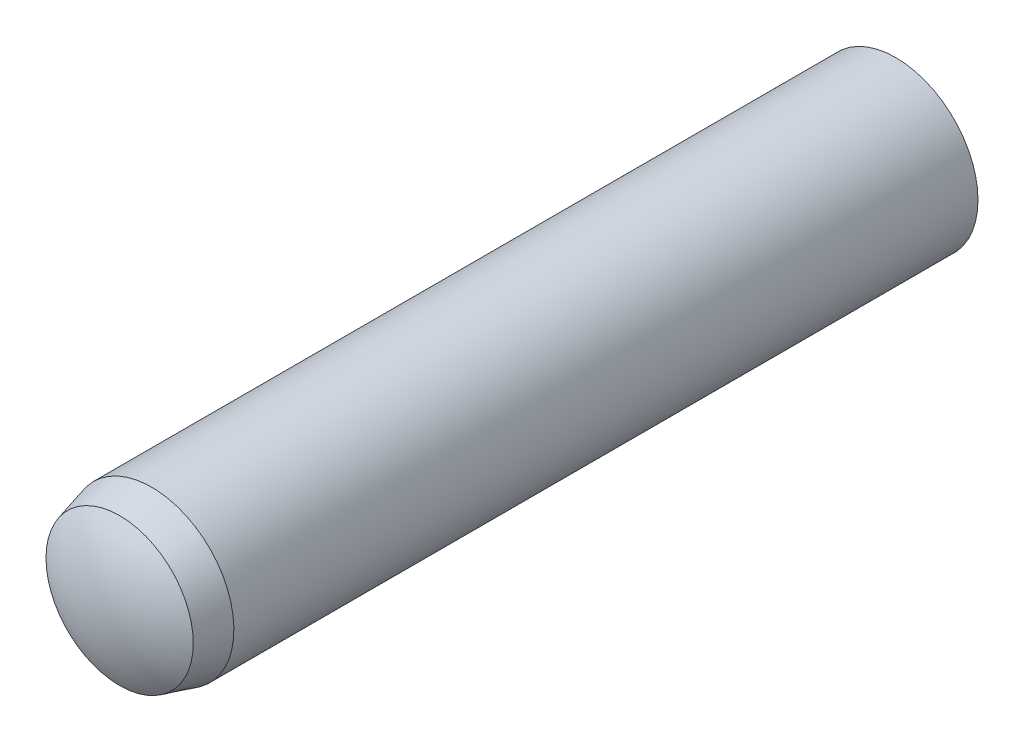
from build123d import *


with BuildPart() as part:
    # Sketch3 → Revolve1 (revolve)
    with BuildSketch(Plane(origin=(0, 0, 0), x_dir=(0, 0, -1), z_dir=(1, 0, 0))):
        with BuildLine():
            Line((-25, 0), (25, 0))
            ThreePointArc((25, 0), (24.616922091, 2.610076627), (23.5, 5))
            Line((23.5, 5), (-21.75, 5))
            Line((-21.75, 5), (-23.7, 4.477499075))
            ThreePointArc((-23.7, 4.477499075), (-24.668425132, 2.331201298), (-25, 0))
        make_face()
    revolve(axis=Axis((0, 0, 25), (0, 0, -1)))


solid = part.part
